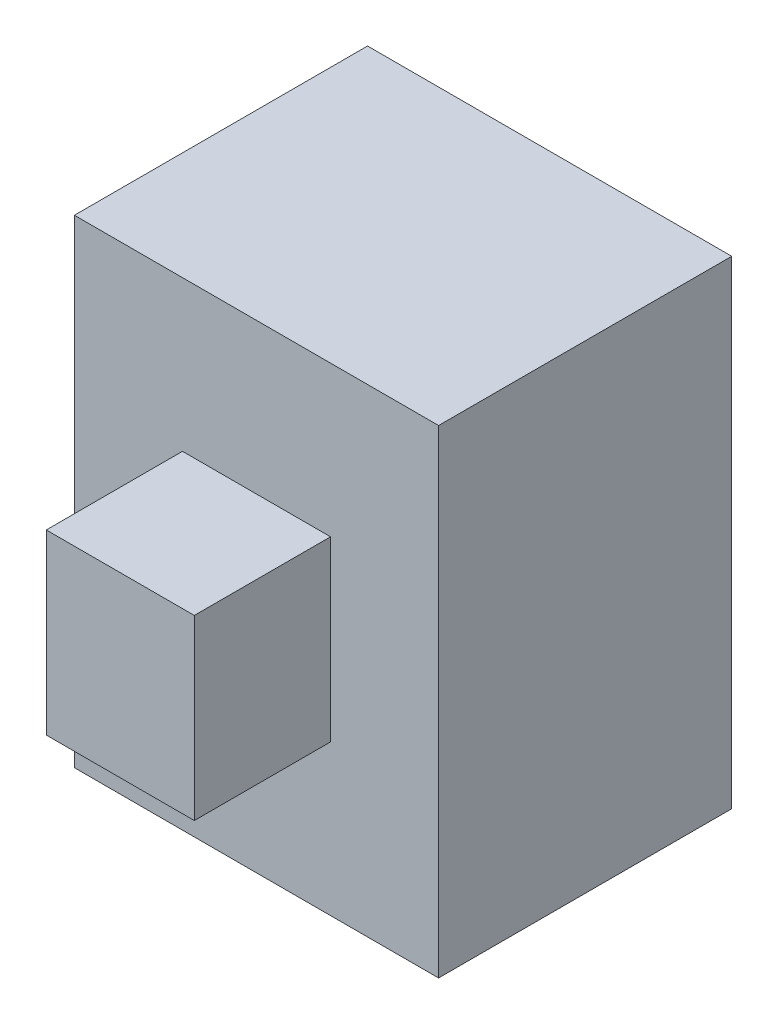
from build123d import *

# Parameters (mm, degrees)
SKETCH1_W           = 15.621
SKETCH1_H           = 20.5232
BOSS_EXTRUDE1_DEPTH = 12.573
SKETCH2_W           = 6.35
SKETCH2_H           = 7.62
BOSS_EXTRUDE2_DEPTH = 5.842


with BuildPart() as part:
    # Sketch1 → Boss-Extrude1 (new body)
    with BuildSketch(Plane.XY):
        Rectangle(SKETCH1_W, SKETCH1_H)
    extrude(amount=BOSS_EXTRUDE1_DEPTH)

    # Sketch2 → Boss-Extrude2 (add)
    with BuildSketch(Plane.XY.offset(12.573)):
        Rectangle(SKETCH2_W, SKETCH2_H)
    extrude(amount=BOSS_EXTRUDE2_DEPTH)


solid = part.part
